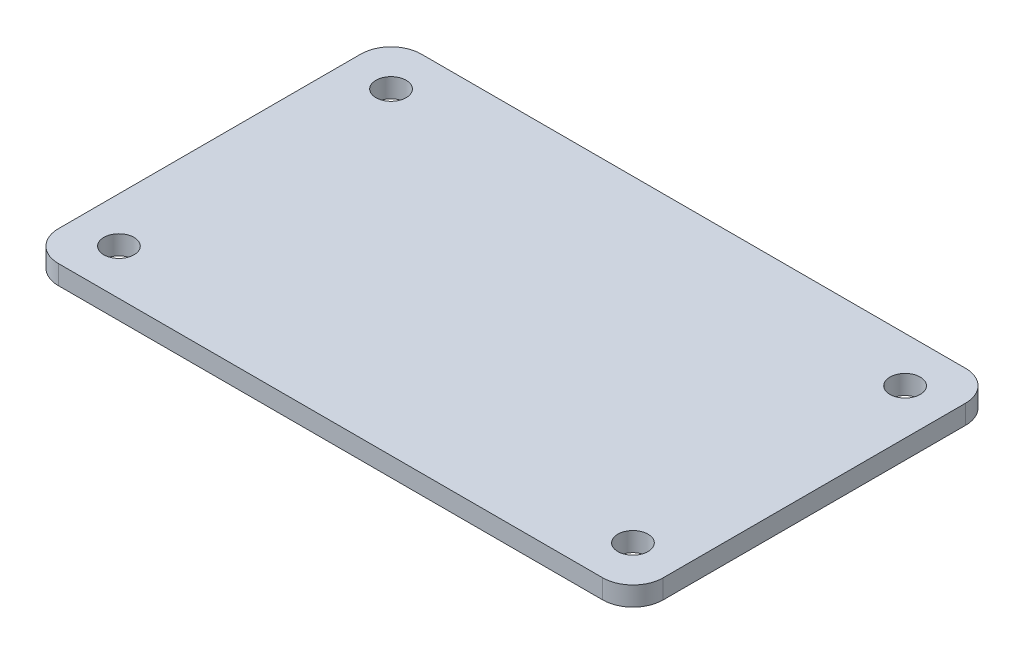
from build123d import *

# Parameters (mm, degrees)
ESQUISSE1_W                     = 200
ESQUISSE1_H                     = 120
BOSS_EXTRU_1_DEPTH              = 6.35
DIAM_TRE_DU_PER_AGE_10_0_10_1_D = 10
CONG_1_R                        = 10


with BuildPart() as part:
    # Esquisse1 → Boss.-Extru.1 (new body)
    with BuildSketch(Plane(origin=(0, 0, 0), x_dir=(1, 0, 0), z_dir=(0, 1, 0))):
        Rectangle(ESQUISSE1_W, ESQUISSE1_H)
    extrude(amount=BOSS_EXTRU_1_DEPTH)

    # Diamètre du perçage Ø10.0 (10)1 (through all)
    with Locations(Plane(origin=(0, 6.35, 0), x_dir=(1, 0, 0), z_dir=(0, 1, 0))):
        with Locations((-85, 45), (-85, -45), (85, -45), (85, 45)):
            Hole(DIAM_TRE_DU_PER_AGE_10_0_10_1_D / 2)

    # Congé1
    cong_1_edges = [part.edges().sort_by_distance(p)[0] for p in [
        (100, 3.175, 60),
        (-100, 3.175, 60),
        (-100, 3.175, -60),
        (100, 3.175, -60),
    ]]
    fillet(cong_1_edges, radius=CONG_1_R)


solid = part.part
